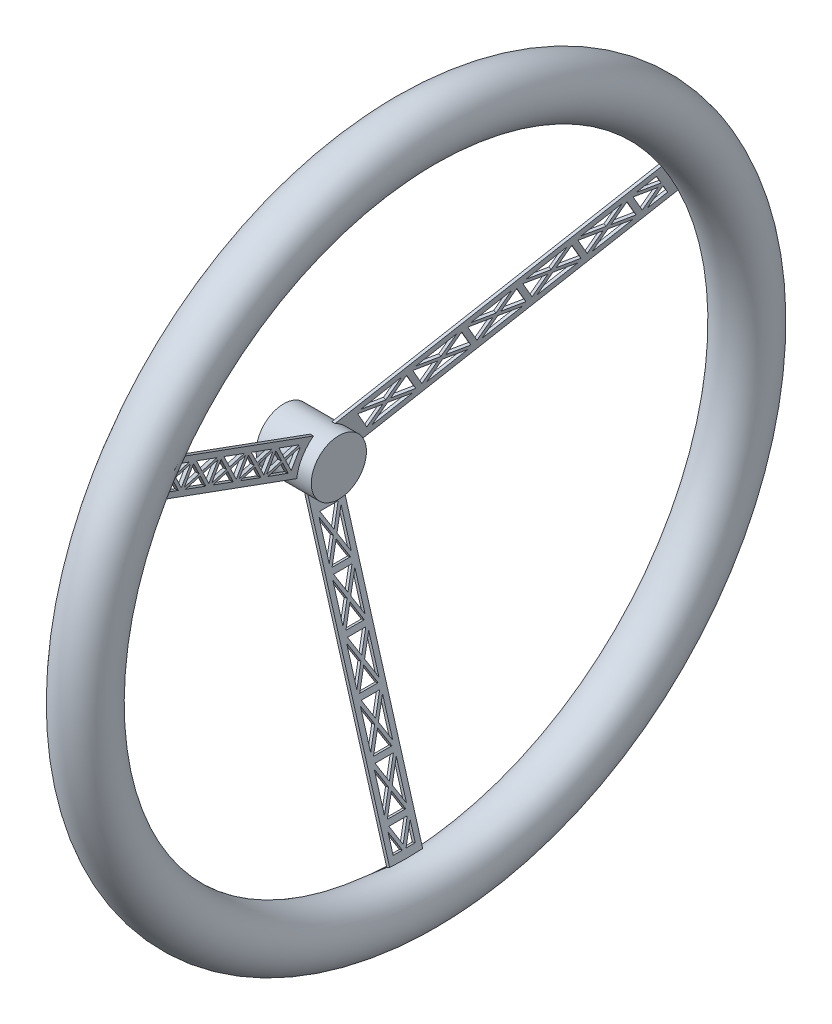
from build123d import *

# Parameters (mm, degrees)
IZIM3_R                     = 12.5
Y_KSEKLIK_EKSTR_ZYON1_START = -40
IZIM5_R                     = 12.5
IZIM5_R_2                   = 7.5
Y_KSEKLIK_EKSTR_ZYON1_DEPTH = 20
Y_KSEKLIK_EKSTR_ZYON2_START = -40
IZIM5_2_R                   = 12.5
Y_KSEKLIK_EKSTR_ZYON2_DEPTH = 5
Y_KSEKLIK_EKSTR_ZYON3_DEPTH = 7.5
KES_EKSTR_ZYON3_DEPTH       = 1.5
DAIRESEL_KAPLAMA1_COUNT     = 3
DAIRESEL_KAPLAMA2_COUNT     = 3


with BuildPart() as part:
    # Çizim3 → Döndür1 (revolve)
    with BuildSketch(Plane.XY):
        with Locations((0, 150)):
            Circle(IZIM3_R)
    revolve(axis=Axis((0, 0, 0), (1, 0, 0)))



with BuildPart() as body_2:
    # Çizim5 → Yükseklik-Ekstrüzyon1 (new body)
    with BuildSketch(Plane(origin=(0, 0, 0), x_dir=(0, 0, -1), z_dir=(1, 0, 0)).offset(Y_KSEKLIK_EKSTR_ZYON1_START)):
        Circle(IZIM5_R)
        Circle(IZIM5_R_2, mode=Mode.SUBTRACT)
    extrude(amount=-Y_KSEKLIK_EKSTR_ZYON1_DEPTH)

    # Çizim5<2> → Yükseklik-Ekstrüzyon2 (add)
    with BuildSketch(Plane(origin=(0, 0, 0), x_dir=(0, 0, -1), z_dir=(1, 0, 0)).offset(Y_KSEKLIK_EKSTR_ZYON2_START)):
        Circle(IZIM5_2_R)
    extrude(amount=Y_KSEKLIK_EKSTR_ZYON2_DEPTH)


with BuildPart() as part_1:
    add(part.part)

    add(body_2.part)  # Yükseklik-Ekstrüzyon3 merges body 2
    # Çizim6 → Yükseklik-Ekstrüzyon3 (add, symmetric)
    with BuildSketch(Plane.XY):
        Polygon((1.333698269, -158.230229013), (-42.624621533, -6.515869831), (-44.079214063, -6.515869831), (-0.166301731, -158.073513166), align=None)
    y_kseklik_ekstr_zyon3 = extrude(amount=Y_KSEKLIK_EKSTR_ZYON3_DEPTH, both=True)

    # Çizim7 → Kes-Ekstrüzyon3 (cut)
    with BuildSketch(Plane(origin=(-41.065077943, -11.898358459, 0), x_dir=(0, 0, -1), z_dir=(0.960494896706401, 0.27829759862593156, 0))):
        Polygon((-5, -7.397556514), (-0.838525492, -15.720505531), (-5, -24.043454548), align=None)
        Polygon((-4.161474508, -5.720505531), (0, -14.043454548), (4.161474508, -5.720505531), align=None)
        Polygon((-4.161474508, -25.720505531), (4.161474508, -25.720505531), (0, -17.397556514), align=None)
        Polygon((5, -7.397556514), (5, -24.043454548), (0.838525492, -15.720505531), align=None)
        Polygon((-5, -29.897556514), (-0.838525492, -38.220505531), (-5, -46.543454548), align=None)
        Polygon((-4.161474508, -28.220505531), (0, -36.543454548), (4.161474508, -28.220505531), align=None)
        Polygon((-4.161474508, -48.220505531), (4.161474508, -48.220505531), (0, -39.897556514), align=None)
        Polygon((5, -29.897556514), (5, -46.543454548), (0.838525492, -38.220505531), align=None)
        Polygon((-5, -52.397556514), (-0.838525492, -60.720505531), (-5, -69.043454548), align=None)
        Polygon((-4.161474508, -50.720505531), (0, -59.043454548), (4.161474508, -50.720505531), align=None)
        Polygon((-4.161474508, -70.720505531), (4.161474508, -70.720505531), (0, -62.397556514), align=None)
        Polygon((5, -52.397556514), (5, -69.043454548), (0.838525492, -60.720505531), align=None)
        Polygon((-5, -74.897556514), (-0.838525492, -83.220505531), (-5, -91.543454548), align=None)
        Polygon((-4.161474508, -73.220505531), (0, -81.543454548), (4.161474508, -73.220505531), align=None)
        Polygon((-4.161474508, -93.220505531), (4.161474508, -93.220505531), (0, -84.897556514), align=None)
        Polygon((5, -74.897556514), (5, -91.543454548), (0.838525492, -83.220505531), align=None)
        Polygon((-5, -97.397556514), (-0.838525492, -105.720505531), (-5, -114.043454548), align=None)
        Polygon((-4.161474508, -95.720505531), (0, -104.043454548), (4.161474508, -95.720505531), align=None)
        Polygon((-4.161474508, -115.720505531), (4.161474508, -115.720505531), (0, -107.397556514), align=None)
        Polygon((5, -97.397556514), (5, -114.043454548), (0.838525492, -105.720505531), align=None)
        Polygon((-5, -119.897556514), (-0.838525492, -128.220505531), (-5, -128.220505531), align=None)
        Polygon((-4.161474508, -118.220505531), (0, -126.543454548), (4.161474508, -118.220505531), align=None)
        Polygon((5, -119.897556514), (5, -128.220505531), (0.838525492, -128.220505531), align=None)
    kes_ekstr_zyon3 = extrude(amount=-KES_EKSTR_ZYON3_DEPTH, mode=Mode.SUBTRACT)

    # Dairesel Kaplama1: Yükseklik-Ekstrüzyon3 ×3 about axis
    dairesel_kaplama1_axis = Axis((-35, 0, 0), (1, 0, 0))
    for i in range(1, DAIRESEL_KAPLAMA1_COUNT):
        add(y_kseklik_ekstr_zyon3.rotate(dairesel_kaplama1_axis, i * 360 / DAIRESEL_KAPLAMA1_COUNT))

    # Dairesel Kaplama2: Kes-Ekstrüzyon3 ×3 about axis
    dairesel_kaplama2_axis = Axis((-35, 0, 0), (1, 0, 0))
    for i in range(1, DAIRESEL_KAPLAMA2_COUNT):
        add(kes_ekstr_zyon3.rotate(dairesel_kaplama2_axis, i * 360 / DAIRESEL_KAPLAMA2_COUNT), mode=Mode.SUBTRACT)


solid = part_1.part
